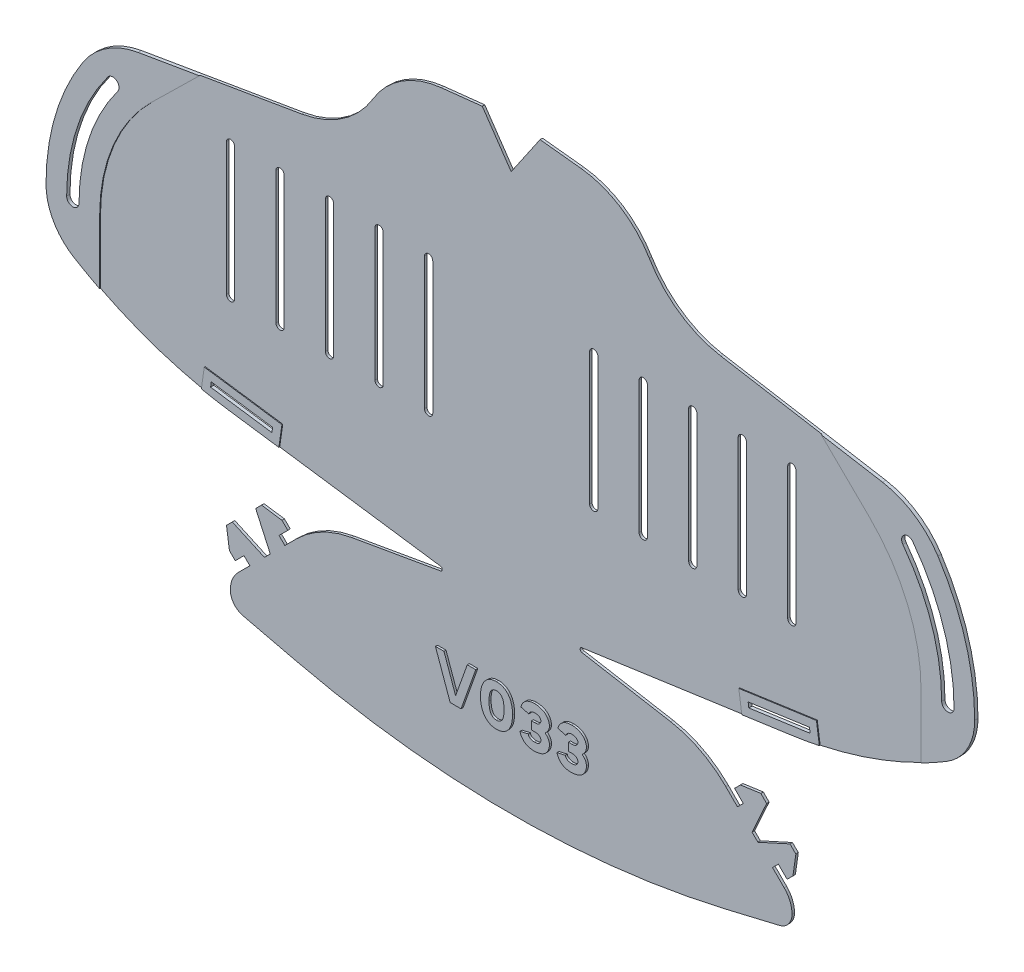
from build123d import *

# Parameters (mm, degrees)
MAIN_SHAPE_DEPTH                   = 0.6
ELASTIC_ATTACHMENT_POINTS_DEPTH    = 184.525502315
REINFORCED_ATTACHMENT_POINTS_DEPTH = 0.2
TAB_SLITS_DEPTH                    = 184.525502315
REINFORCED_TAB_SLITS_DEPTH         = 0.2
TAB_FLEX_RELIEF_DEPTH              = 184.525502315
TAB_FLEX_RELIEF_DEPTH_BACK         = 184.525502315
BREATHING_SLITS_DEPTH              = 184.525502315
VERSION_NUMBER_DEPTH               = 0.5
FILLET1_R                          = 0.5


with BuildPart() as part:
    # Sketch1 → Main Shape (new body)
    with BuildSketch(Plane.XY):
        with BuildLine():
            Line((0, -10.235233266), (-7, 0))
            Line((-7, 0), (-16.941855461, -1.076805455))
            ThreePointArc((-16.941855461, -1.076805455), (-26.448172688, -4.42923559), (-33.461443341, -11.669600897))
            ThreePointArc((-33.461443341, -11.669600897), (-40.804108255, -19.481824954), (-50.74391922, -23.5))
            Line((-50.74391922, -23.5), (-90.180351554, -30.190874742))
            ThreePointArc((-90.180351554, -30.190874742), (-97.811505455, -33.190405434), (-103.597722286, -39))
            ThreePointArc((-103.597722286, -39), (-110.227482046, -53.35351039), (-112.5, -69))
            ThreePointArc((-112.5, -69), (-110.685143325, -75.893640703), (-105.711102551, -81))
            ThreePointArc((-105.711102551, -81), (-87.655491519, -89.524485559), (-68.266232563, -94.291935705))
            Line((-68.266232563, -94.291935705), (-14, -102))
            Line((-14, -102), (-38.626554922, -106.304973016))
            ThreePointArc((-38.626554922, -106.304973016), (-45.849449199, -108.748014338), (-52, -113.254607005))
            Line((-52, -113.254607005), (-54.828307349, -116.0831539))
            Line((-54.828307349, -116.0831539), (-56.242580797, -114.669000226))
            Line((-56.242580797, -114.669000226), (-54.121350285, -112.547590054))
            Line((-54.121350285, -112.547590054), (-55.535623732, -111.13343638))
            Line((-55.535623732, -111.13343638), (-60.48540114, -110.426539202))
            Line((-60.48540114, -110.426539202), (-68.970323187, -118.912179887))
            Line((-68.970323187, -118.912179887), (-68.263006804, -123.861897408))
            Line((-68.263006804, -123.861897408), (-66.848733357, -125.276051082))
            Line((-66.848733357, -125.276051082), (-64.727502845, -123.154640911))
            Line((-64.727502845, -123.154640911), (-63.313229397, -124.568794586))
            Line((-63.313229397, -124.568794586), (-66.141536747, -127.397341481))
            ThreePointArc((-66.141536747, -127.397341481), (-67.550417669, -129.506025763), (-68.045148042, -131.993340924))
            ThreePointArc((-68.045148042, -131.993340924), (-67.183295285, -134.473669911), (-64.9691321, -135.885159709))
            Line((-64.9691321, -135.885159709), (-52.436095294, -138.860716087))
            ThreePointArc((-52.436095294, -138.860716087), (-26.397134772, -143.459954927), (0, -145))
            ThreePointArc((0, -145), (26.397134772, -143.459954927), (52.436095294, -138.860716087))
            Line((52.436095294, -138.860716087), (64.9691321, -135.885159709))
            ThreePointArc((64.9691321, -135.885159709), (67.183295285, -134.473669911), (68.045148042, -131.993340924))
            ThreePointArc((68.045148042, -131.993340924), (67.550417669, -129.506025763), (66.141536747, -127.397341481))
            Line((66.141536747, -127.397341481), (63.313229397, -124.568794586))
            Line((63.313229397, -124.568794586), (64.727502845, -123.154640911))
            Line((64.727502845, -123.154640911), (66.848733357, -125.276051082))
            Line((66.848733357, -125.276051082), (68.263006804, -123.861897408))
            Line((68.263006804, -123.861897408), (68.970323187, -118.912179887))
            Line((68.970323187, -118.912179887), (60.48540114, -110.426539202))
            Line((60.48540114, -110.426539202), (55.535623732, -111.13343638))
            Line((55.535623732, -111.13343638), (54.121350285, -112.547590054))
            Line((54.121350285, -112.547590054), (56.242580797, -114.669000226))
            Line((56.242580797, -114.669000226), (54.828307349, -116.0831539))
            Line((54.828307349, -116.0831539), (52, -113.254607005))
            ThreePointArc((52, -113.254607005), (45.849449199, -108.748014338), (38.626554922, -106.304973016))
            Line((38.626554922, -106.304973016), (14, -102))
            Line((14, -102), (68.266232563, -94.291935705))
            ThreePointArc((68.266232563, -94.291935705), (87.655491519, -89.524485559), (105.711102551, -81))
            ThreePointArc((105.711102551, -81), (110.685143325, -75.893640703), (112.5, -69))
            ThreePointArc((112.5, -69), (110.227482046, -53.35351039), (103.597722286, -39))
            ThreePointArc((103.597722286, -39), (97.811505455, -33.190405434), (90.180351554, -30.190874742))
            Line((90.180351554, -30.190874742), (50.74391922, -23.5))
            ThreePointArc((50.74391922, -23.5), (40.804108255, -19.481824954), (33.461443341, -11.669600897))
            ThreePointArc((33.461443341, -11.669600897), (26.448172688, -4.42923559), (16.941855461, -1.076805455))
            Line((16.941855461, -1.076805455), (7, 0))
            Line((7, 0), (0, -10.235233266))
        make_face()
    extrude(amount=MAIN_SHAPE_DEPTH)

    # Sketch2 → Elastic Attachment Points (cut, through all)
    with BuildSketch(Plane.XY.offset(0.6)):
        with BuildLine():
            ThreePointArc((-97.5, -39), (-104.934164903, -53.188611699), (-107.5, -69))
            ThreePointArc((-107.5, -69), (-106, -70.5), (-104.5, -69))
            ThreePointArc((-104.5, -69), (-102.088115008, -54.137294997), (-95.1, -40.8))
            ThreePointArc((-95.1, -40.8), (-95.4, -38.7), (-97.5, -39))
        make_face()
        with BuildLine():
            ThreePointArc((97.5, -39), (104.934164903, -53.188611699), (107.5, -69))
            ThreePointArc((107.5, -69), (106, -70.5), (104.5, -69))
            ThreePointArc((104.5, -69), (102.088115008, -54.137294997), (95.1, -40.8))
            ThreePointArc((95.1, -40.8), (95.4, -38.7), (97.5, -39))
        make_face()
    extrude(amount=-ELASTIC_ATTACHMENT_POINTS_DEPTH, mode=Mode.SUBTRACT)

    # Sketch7 → Reinforced Attachment Points (add)
    # profile 1 of 2: a face of its own
    with BuildSketch(Plane.XY.offset(0.6)):
        with BuildLine():
            Line((-99.5, -69), (-99.5, -84.438405623))
            ThreePointArc((-99.5, -84.438405623), (-102.636073846, -82.774338486), (-105.711102551, -81))
            ThreePointArc((-105.711102551, -81), (-110.685143325, -75.893640703), (-112.5, -69))
            ThreePointArc((-112.5, -69), (-110.227482046, -53.35351039), (-103.597722286, -39))
            ThreePointArc((-103.597722286, -39), (-97.811505455, -33.190405434), (-90.180351554, -30.190874742))
            Line((-90.180351554, -30.190874742), (-75.331937335, -27.671659038))
            Line((-75.331937335, -27.671659038), (-86.893876913, -39))
            ThreePointArc((-86.893876913, -39), (-96.22042633, -52.729517991), (-99.5, -69))
        make_face()
        with BuildLine():
            ThreePointArc((-107.5, -69), (-106, -70.5), (-104.5, -69))
            ThreePointArc((-104.5, -69), (-102.088115008, -54.137294997), (-95.1, -40.8))
            ThreePointArc((-95.1, -40.8), (-95.4, -38.7), (-97.5, -39))
            ThreePointArc((-97.5, -39), (-104.934164903, -53.188611699), (-107.5, -69))
        make_face(mode=Mode.SUBTRACT)
    # profile 2 of 2: a face of its own
    with BuildSketch(Plane.XY.offset(0.6)):
        with BuildLine():
            Line((75.331937335, -27.671659038), (90.180351554, -30.190874742))
            ThreePointArc((90.180351554, -30.190874742), (97.811505455, -33.190405434), (103.597722286, -39))
            ThreePointArc((103.597722286, -39), (110.227482046, -53.35351039), (112.5, -69))
            ThreePointArc((112.5, -69), (110.685143325, -75.893640703), (105.711102551, -81))
            ThreePointArc((105.711102551, -81), (102.636073846, -82.774338486), (99.5, -84.438405623))
            Line((99.5, -84.438405623), (99.5, -69))
            ThreePointArc((99.5, -69), (96.22042633, -52.729517991), (86.893876913, -39))
            Line((86.893876913, -39), (75.331937335, -27.671659038))
        make_face()
        with BuildLine():
            ThreePointArc((104.5, -69), (106, -70.5), (107.5, -69))
            ThreePointArc((107.5, -69), (104.934164903, -53.188611699), (97.5, -39))
            ThreePointArc((97.5, -39), (95.4, -38.7), (95.1, -40.8))
            ThreePointArc((95.1, -40.8), (102.088115008, -54.137294997), (104.5, -69))
        make_face(mode=Mode.SUBTRACT)
    extrude(amount=REINFORCED_ATTACHMENT_POINTS_DEPTH)

    # Sketch6 → Tab Slits (cut, through all)
    with BuildSketch(Plane.XY.offset(0.6)):
        Polygon((-72.627441637, -91.652387373), (-57.776508424, -93.761838179), (-57.60775236, -92.573763522), (-72.458685573, -90.464312716), align=None)
        Polygon((72.627441637, -91.652387373), (72.458685573, -90.464312716), (57.60775236, -92.573763522), (57.776508424, -93.761838179), align=None)
    extrude(amount=-TAB_SLITS_DEPTH, mode=Mode.SUBTRACT)

    # Sketch9 → Reinforced Tab Slits (add)
    # profile 1 of 2: a face of its own
    with BuildSketch(Plane.XY.offset(0.6)):
        with BuildLine():
            Line((-56.077644103, -96.023222715), (-55.346367824, -90.874899201))
            Line((-55.346367824, -90.874899201), (-74.157549894, -88.20292818))
            Line((-74.157549894, -88.20292818), (-74.857329404, -93.129508476))
            ThreePointArc((-74.857329404, -93.129508476), (-71.571508598, -93.76587879), (-68.266232563, -94.291935705))
            Line((-68.266232563, -94.291935705), (-56.077644103, -96.023222715))
        make_face()
        Polygon((-57.776508424, -93.761838179), (-57.60775236, -92.573763522), (-72.458685573, -90.464312716), (-72.627441637, -91.652387373), align=None, mode=Mode.SUBTRACT)
    # profile 2 of 2: a face of its own
    with BuildSketch(Plane.XY.offset(0.6)):
        with BuildLine():
            Line((68.266232563, -94.291935705), (56.077644103, -96.023222715))
            Line((56.077644103, -96.023222715), (55.346367824, -90.874899201))
            Line((55.346367824, -90.874899201), (74.157549894, -88.20292818))
            Line((74.157549894, -88.20292818), (74.857329404, -93.129508476))
            ThreePointArc((74.857329404, -93.129508476), (71.571508598, -93.76587879), (68.266232563, -94.291935705))
        make_face()
        Polygon((57.60775236, -92.573763522), (72.458685573, -90.464312716), (72.627441637, -91.652387373), (57.776508424, -93.761838179), align=None, mode=Mode.SUBTRACT)
    extrude(amount=REINFORCED_TAB_SLITS_DEPTH)

    # Sketch11 → Tab Flex Relief (cut, two sides: drawn at the far end of the back side and taken through both)
    with BuildSketch(Plane.XY.offset(0.6).offset(-TAB_FLEX_RELIEF_DEPTH_BACK)):
        Polygon((-67.556169513, -117.49790644), (-59.777845211, -121.033110967), (-58.363691536, -119.618837519), (-61.899554814, -111.840812649), align=None)
        Polygon((61.899554814, -111.840812649), (67.556169513, -117.49790644), (59.777845211, -121.033110967), (58.363691536, -119.618837519), align=None)
    extrude(amount=TAB_FLEX_RELIEF_DEPTH + TAB_FLEX_RELIEF_DEPTH_BACK, mode=Mode.SUBTRACT)

    # Sketch3 → Breathing Slits (cut, through all)
    with BuildSketch(Plane.XY.offset(0.6)):
        with BuildLine():
            Line((-19, -38.45), (-19, -70.45))
            ThreePointArc((-19, -70.45), (-20, -71.45), (-21, -70.45))
            Line((-21, -70.45), (-21, -38.45))
            ThreePointArc((-21, -38.45), (-20, -37.45), (-19, -38.45))
        make_face()
        with BuildLine():
            Line((-31, -38.45), (-31, -70.45))
            ThreePointArc((-31, -70.45), (-32, -71.45), (-33, -70.45))
            Line((-33, -70.45), (-33, -38.45))
            ThreePointArc((-33, -38.45), (-32, -37.45), (-31, -38.45))
        make_face()
        with BuildLine():
            Line((-43, -38.45), (-43, -70.45))
            ThreePointArc((-43, -70.45), (-44, -71.45), (-45, -70.45))
            Line((-45, -70.45), (-45, -38.45))
            ThreePointArc((-45, -38.45), (-44, -37.45), (-43, -38.45))
        make_face()
        with BuildLine():
            Line((-55, -38.45), (-55, -70.45))
            ThreePointArc((-55, -70.45), (-56, -71.45), (-57, -70.45))
            Line((-57, -70.45), (-57, -38.45))
            ThreePointArc((-57, -38.45), (-56, -37.45), (-55, -38.45))
        make_face()
        with BuildLine():
            Line((-67, -38.45), (-67, -70.45))
            ThreePointArc((-67, -70.45), (-68, -71.45), (-69, -70.45))
            Line((-69, -70.45), (-69, -38.45))
            ThreePointArc((-69, -38.45), (-68, -37.45), (-67, -38.45))
        make_face()
        with BuildLine():
            Line((19, -38.45), (19, -70.45))
            ThreePointArc((19, -70.45), (20, -71.45), (21, -70.45))
            Line((21, -70.45), (21, -38.45))
            ThreePointArc((21, -38.45), (20, -37.45), (19, -38.45))
        make_face()
        with BuildLine():
            Line((31, -38.45), (31, -70.45))
            ThreePointArc((31, -70.45), (32, -71.45), (33, -70.45))
            Line((33, -70.45), (33, -38.45))
            ThreePointArc((33, -38.45), (32, -37.45), (31, -38.45))
        make_face()
        with BuildLine():
            Line((43, -38.45), (43, -70.45))
            ThreePointArc((43, -70.45), (44, -71.45), (45, -70.45))
            Line((45, -70.45), (45, -38.45))
            ThreePointArc((45, -38.45), (44, -37.45), (43, -38.45))
        make_face()
        with BuildLine():
            Line((55, -38.45), (55, -70.45))
            ThreePointArc((55, -70.45), (56, -71.45), (57, -70.45))
            Line((57, -70.45), (57, -38.45))
            ThreePointArc((57, -38.45), (56, -37.45), (55, -38.45))
        make_face()
        with BuildLine():
            Line((67, -38.45), (67, -70.45))
            ThreePointArc((67, -70.45), (68, -71.45), (69, -70.45))
            Line((69, -70.45), (69, -38.45))
            ThreePointArc((69, -38.45), (68, -37.45), (67, -38.45))
        make_face()
    extrude(amount=-BREATHING_SLITS_DEPTH, mode=Mode.SUBTRACT)

    # Sketch8 → Version Number (add)
    # profile 1 of 4: a face of its own
    with BuildSketch(Plane.XY.offset(0.6)):
        Polygon((-14.279551662, -128.5), (-11.644631028, -128.5), (-8.073202456, -118.5), (-10.13669452, -118.5), (-12.962091345, -126.420634921), (-15.78748817, -118.5), (-17.850980234, -118.5), align=None)
    # profile 2 of 4: a face of its own
    with BuildSketch(Plane.XY.offset(0.6)):
        with BuildLine():
            add(Edge.make_bspline(
                [(-3.051027777, -118.5), (-3.19539374, -118.505695671), (-3.478148888, -118.51685121), (-3.891283889, -118.5745591), (-4.279126593, -118.680335178), (-4.646328168, -118.819656178), (-4.98860374, -119.003303471), (-5.312396914, -119.221085059), (-5.605407529, -119.487440084), (-5.880862582, -119.785519386), (-6.126725763, -120.12453761), (-6.340161473, -120.500892889), (-6.522124249, -120.912503383), (-6.671045413, -121.360169436), (-6.786594461, -121.844506854), (-6.8743484, -122.364485904), (-6.925902839, -122.921030718), (-6.936559569, -123.303893775), (-6.942038151, -123.500722112)],
                knots=[0, 0, 0, 0, 0.970159994, 1.900155169, 2.79438565, 3.665191596, 4.532301255, 5.397946305, 6.279238358, 7.185391655, 8.120220805, 9.085107467, 10.08639026, 11.138349125, 12.249459105, 13.427760297, 14.677622047, 16, 16, 16, 16], degree=3))
            add(Edge.make_bspline(
                [(-6.942038151, -123.500722112), (-6.93661476, -123.69832053), (-6.926106134, -124.081196856), (-6.874139064, -124.637697099), (-6.786693174, -125.156966907), (-6.670583318, -125.641884177), (-6.522640654, -126.090648826), (-6.340094029, -126.502814664), (-6.126783725, -126.879260377), (-5.880702545, -127.218032326), (-5.606310807, -127.51659595), (-5.310843261, -127.779877259), (-4.989492019, -128.000979952), (-4.646134714, -128.183632701), (-4.279581659, -128.324409639), (-3.89062858, -128.425104033), (-3.47885026, -128.488808035), (-3.196068886, -128.496221224), (-3.051924811, -128.5)],
                knots=[0, 0, 0, 0, 1.327400251, 2.57203543, 3.750234214, 4.861247624, 5.917991082, 6.919186852, 7.883989653, 8.818737555, 9.724812096, 10.602616666, 11.47109776, 12.338132057, 13.208862319, 14.101698703, 15.032365954, 16, 16, 16, 16], degree=3))
            add(Edge.make_bspline(
                [(-3.051924811, -128.5), (-2.907785142, -128.496210687), (-2.625012412, -128.488776824), (-2.213171998, -128.425221319), (-1.823749667, -128.323813307), (-1.456388189, -128.184839888), (-1.11399871, -128.000200623), (-0.792952303, -127.779984633), (-0.497553635, -127.516566079), (-0.223143835, -127.218040576), (0.022936792, -126.879258594), (0.236229534, -126.502813072), (0.418851411, -126.090657611), (0.566489149, -125.641847927), (0.683801999, -125.157235462), (0.766244145, -124.637275213), (0.82390037, -124.081441513), (0.831810739, -123.698369528), (0.835892123, -123.500722112)],
                knots=[0, 0, 0, 0, 0.96765053, 1.898333634, 2.791185227, 3.666728435, 4.529238626, 5.397734515, 6.275554038, 7.181644014, 8.116407839, 9.081227075, 10.082439899, 11.139201358, 12.250233695, 13.427610983, 14.672766316, 16, 16, 16, 16], degree=3))
            add(Edge.make_bspline(
                [(0.835892123, -123.500722112), (0.831751293, -123.303845261), (0.823694588, -122.920787111), (0.766450609, -122.364907693), (0.683702415, -121.844238468), (0.566952779, -121.360205444), (0.418334814, -120.912494629), (0.236296996, -120.500894477), (0.022878819, -120.124539393), (-0.222983775, -119.785511139), (-0.498457012, -119.487469991), (-0.79139822, -119.220977415), (-1.114883082, -119.004075275), (-1.45619473, -118.818455332), (-1.824205294, -118.680915067), (-2.212521926, -118.574534625), (-2.625371004, -118.516562336), (-2.907855835, -118.506550382), (-3.051924811, -118.501444225)],
                knots=[0, 0, 0, 0, 1.322391154, 2.572941942, 3.750582404, 4.861863084, 5.913983562, 6.915420183, 7.880455081, 8.815427849, 9.721720359, 10.603147806, 11.468925845, 12.331628829, 13.207367743, 14.101735605, 15.031873656, 16, 16, 16, 16], degree=3))
            Line((-3.051924811, -118.501444225), (-3.051027777, -118.5))
        make_face()
        with BuildLine():
            add(Edge.make_bspline(
                [(-3.051027777, -126.579365079), (-3.120347324, -126.580142247), (-3.25635765, -126.581667111), (-3.453810887, -126.549518886), (-3.640261982, -126.50001124), (-3.814439277, -126.424863461), (-3.978234638, -126.32888552), (-4.128850181, -126.207295998), (-4.267209205, -126.063513987), (-4.394524263, -125.896932623), (-4.508395565, -125.703005633), (-4.606926554, -125.478827118), (-4.687663969, -125.222713054), (-4.756840727, -124.937433189), (-4.808092092, -124.621763618), (-4.846595657, -124.276117752), (-4.872462321, -123.899148475), (-4.875821596, -123.63702081), (-4.87756832, -123.500722112)],
                knots=[0, 0, 0, 0, 0.820209436, 1.609314487, 2.362064528, 3.101854642, 3.850272983, 4.605479342, 5.3882482, 6.210255141, 7.084711649, 8.047345167, 9.106040688, 10.263495908, 11.523832392, 12.893430008, 14.384674726, 16, 16, 16, 16], degree=3))
            add(Edge.make_bspline(
                [(-4.87756832, -123.500722112), (-4.875814709, -123.364424703), (-4.87244219, -123.102299516), (-4.846666545, -122.725313211), (-4.807773571, -122.378974061), (-4.757477287, -122.063111109), (-4.687259864, -121.778059679), (-4.606956833, -121.522619394), (-4.508426672, -121.298401339), (-4.394392013, -121.104640769), (-4.268001709, -120.937923887), (-4.128039223, -120.796456824), (-3.978318472, -120.674830172), (-3.814478587, -120.578630118), (-3.639832567, -120.50465551), (-3.45446502, -120.450210023), (-3.256321312, -120.423926373), (-3.120878039, -120.422146526), (-3.051924811, -120.421240419)],
                knots=[0, 0, 0, 0, 1.616177311, 3.108208617, 4.478528655, 5.748482895, 6.897727805, 7.956981757, 8.920123036, 9.795040793, 10.617481319, 11.394165711, 12.149770419, 12.898583529, 13.63876386, 14.394368568, 15.182584207, 16, 16, 16, 16], degree=3))
            add(Edge.make_bspline(
                [(-3.051924811, -120.421240419), (-2.982973175, -120.422149219), (-2.847533031, -120.423934355), (-2.64936681, -120.450179948), (-2.464080223, -120.504762296), (-2.289746876, -120.577982734), (-2.127521541, -120.675595023), (-1.978051783, -120.796360516), (-1.838151536, -120.937948802), (-1.711787224, -121.104645093), (-1.597562487, -121.298351736), (-1.499777206, -121.523063414), (-1.415817348, -121.777554553), (-1.346628249, -122.063195246), (-1.29599857, -122.378948588), (-1.257206456, -122.725320897), (-1.231400792, -123.102297333), (-1.228032641, -123.364423957), (-1.226281301, -123.500722112)],
                knots=[0, 0, 0, 0, 0.817669415, 1.606129616, 2.361968767, 3.102378757, 3.843623451, 4.599462602, 5.376387978, 6.199083685, 7.074272906, 8.037713021, 9.100132017, 10.249733507, 11.520081779, 12.89082699, 14.383321233, 16, 16, 16, 16], degree=3))
            add(Edge.make_bspline(
                [(-1.226281301, -123.500722112), (-1.228025755, -123.637021556), (-1.231380663, -123.899150658), (-1.257277338, -124.276110066), (-1.295680288, -124.621789015), (-1.347263507, -124.937349474), (-1.415405372, -125.223220708), (-1.499806884, -125.478383327), (-1.597593739, -125.703055181), (-1.711654918, -125.896928348), (-1.838944061, -126.063488884), (-1.977240151, -126.207393621), (-2.12760424, -126.328120602), (-2.289785467, -126.425517476), (-2.463650718, -126.499891817), (-2.650020055, -126.549600883), (-2.847209684, -126.581404352), (-2.98290822, -126.580608552), (-3.051924811, -126.580203806)],
                knots=[0, 0, 0, 0, 1.616177474, 3.108208932, 4.478529109, 5.739530511, 6.897596372, 7.959685938, 8.922827315, 9.797745161, 10.620185771, 11.403367596, 12.15897238, 12.899987232, 13.640167639, 14.39331481, 15.182836171, 16, 16, 16, 16], degree=3))
            Line((-3.051924811, -126.580203806), (-3.051027777, -126.579365079))
        make_face(mode=Mode.SUBTRACT)
    # profile 3 of 4: a face of its own
    with BuildSketch(Plane.XY.offset(0.6)):
        with BuildLine():
            Line((6.271577031, -124.404761905), (6.366815126, -124.404761905))
            add(Edge.make_bspline(
                [(6.366815126, -124.404761905), (6.467083021, -124.411299477), (6.657718223, -124.423729091), (6.924384519, -124.486416557), (7.157178608, -124.578961335), (7.348865985, -124.709274647), (7.502511287, -124.861365804), (7.616838726, -125.032278467), (7.68649997, -125.222537651), (7.695375407, -125.355662585), (7.699852438, -125.422814713)],
                knots=[0, 0, 0, 0, 1.293250512, 2.458803691, 3.516087315, 4.504014474, 5.424976382, 6.287022232, 7.135923681, 8, 8, 8, 8], degree=3))
            add(Edge.make_bspline(
                [(7.699852438, -125.422814713), (7.696562888, -125.504440638), (7.690201902, -125.662280257), (7.62105453, -125.887718235), (7.502699673, -126.087113891), (7.367783836, -126.23073656), (7.23861918, -126.331172702), (7.123730184, -126.395688771), (6.994879285, -126.450185226), (6.851851279, -126.49595932), (6.69512982, -126.532200484), (6.524170883, -126.560253509), (6.33834716, -126.575366879), (6.209508164, -126.5785552), (6.142888539, -126.580203806)],
                knots=[0, 0, 0, 0, 1.334208421, 2.579951764, 3.816761299, 5.103436918, 5.78324123, 6.491044783, 7.25516555, 8.072210043, 8.94833879, 9.888551629, 10.908219533, 12, 12, 12, 12], degree=3))
            add(Edge.make_bspline(
                [(6.142888539, -126.580203806), (6.068494948, -126.579024673), (5.918010355, -126.576639503), (5.691363809, -126.537785365), (5.463088851, -126.472292557), (5.235991452, -126.384048723), (5.021834851, -126.26078738), (4.844512322, -126.088542309), (4.703342567, -125.87591894), (4.648773412, -125.712337396), (4.620370744, -125.62719493)],
                knots=[0, 0, 0, 0, 0.920255672, 1.861508472, 2.836752399, 3.857684402, 4.873720033, 5.872631744, 6.892727297, 8, 8, 8, 8], degree=3))
            Line((4.620370744, -125.62719493), (2.636656396, -126.071428571))
            add(Edge.make_bspline(
                [(2.636656396, -126.071428571), (2.65949168, -126.160336196), (2.704447825, -126.335369884), (2.797456704, -126.586847228), (2.908894142, -126.824009097), (3.034050485, -127.050933458), (3.182201572, -127.26169635), (3.346370111, -127.459934114), (3.525601641, -127.647890635), (3.725933933, -127.819546753), (3.943380911, -127.976110236), (4.180527485, -128.112422888), (4.435092983, -128.230322428), (4.710630373, -128.322934743), (5.002747988, -128.399729339), (5.314016557, -128.45295857), (5.642847536, -128.491934936), (5.868729028, -128.497268097), (5.984436461, -128.5)],
                knots=[0, 0, 0, 0, 0.97897001, 1.927311989, 2.855460552, 3.773345826, 4.68872018, 5.599601379, 6.518067916, 7.456260856, 8.41049365, 9.372940738, 10.370680865, 11.39871829, 12.470472684, 13.590411754, 14.765692276, 16, 16, 16, 16], degree=3))
            add(Edge.make_bspline(
                [(5.984436461, -128.5), (6.140706347, -128.494245394), (6.443232397, -128.483104934), (6.881041186, -128.435865678), (7.286689568, -128.358387224), (7.66046436, -128.252017359), (8.005338054, -128.123277608), (8.316323474, -127.961059217), (8.598414909, -127.774497038), (8.846068931, -127.55815064), (9.060463644, -127.319870658), (9.252221218, -127.071551477), (9.410010509, -126.805353082), (9.542541163, -126.527874631), (9.641168787, -126.234513517), (9.712632491, -125.928607165), (9.754304892, -125.607680152), (9.759422526, -125.38925418), (9.762025861, -125.278141077)],
                knots=[0, 0, 0, 0, 1.338573179, 2.591371041, 3.766159492, 4.869841347, 5.915366975, 6.911991706, 7.866279139, 8.804635322, 9.718527085, 10.607232931, 11.486170613, 12.362759498, 13.235296616, 14.130311397, 15.048891017, 16, 16, 16, 16], degree=3))
            add(Edge.make_bspline(
                [(9.762025861, -125.278141077), (9.756677435, -125.181448476), (9.746150675, -124.991138356), (9.69083509, -124.713321084), (9.598475202, -124.451246621), (9.469283463, -124.20784025), (9.318083758, -123.977552327), (9.142952342, -123.764837772), (8.948555296, -123.566155092), (8.80413063, -123.449574998), (8.73093915, -123.39049458)],
                knots=[0, 0, 0, 0, 1.042147361, 2.051151675, 3.039496243, 4.024119517, 5.012016893, 6.002285516, 6.987598979, 8, 8, 8, 8], degree=3))
            add(Edge.make_bspline(
                [(8.73093915, -123.39049458), (8.804120184, -123.325162044), (8.948480941, -123.19628365), (9.142753063, -122.981710509), (9.316923769, -122.755542958), (9.470279521, -122.515248899), (9.597481046, -122.261642739), (9.690305135, -121.993228321), (9.746213398, -121.711764564), (9.756698785, -121.519933272), (9.762025861, -121.42247384)],
                knots=[0, 0, 0, 0, 1.026734164, 2.025389794, 3.025877614, 4.013273499, 5.006315215, 5.989929209, 6.978788314, 8, 8, 8, 8], degree=3))
            add(Edge.make_bspline(
                [(9.762025861, -121.42247384), (9.757943996, -121.322020203), (9.749925017, -121.124675201), (9.70298232, -120.835115028), (9.627804305, -120.558271626), (9.520362248, -120.294880847), (9.386946652, -120.042407113), (9.222134738, -119.803370965), (9.03110556, -119.574583887), (8.810274701, -119.361344215), (8.563575543, -119.166999953), (8.291767327, -118.995833154), (7.997228637, -118.84746887), (7.676452584, -118.730513446), (7.334536967, -118.632405283), (6.968657131, -118.562780212), (6.579581976, -118.515976725), (6.312193885, -118.506371293), (6.175038236, -118.501444225)],
                knots=[0, 0, 0, 0, 0.933249724, 1.833404674, 2.71837752, 3.592513965, 4.4704886, 5.365912677, 6.284554944, 7.234984132, 8.212272519, 9.196674926, 10.214289296, 11.269589965, 12.363543901, 13.515449053, 14.72555956, 16, 16, 16, 16], degree=3))
            add(Edge.make_bspline(
                [(6.175038236, -118.501444225), (6.061645884, -118.504384419), (5.840465125, -118.510119502), (5.517680855, -118.546209564), (5.21185155, -118.597359567), (4.923032824, -118.671164203), (4.651989267, -118.76520159), (4.398267184, -118.877770477), (4.16173765, -119.009217236), (3.94413438, -119.161041577), (3.743873805, -119.328960798), (3.562476817, -119.510905494), (3.397729823, -119.704452098), (3.253195647, -119.91288512), (3.123566172, -120.132286581), (3.017031143, -120.36651166), (2.922112184, -120.610059019), (2.878707966, -120.780460499), (2.856730222, -120.866743363)],
                knots=[0, 0, 0, 0, 1.229240767, 2.397731417, 3.51786287, 4.588673614, 5.625367482, 6.624717489, 7.594406979, 8.554388623, 9.496885304, 10.424058211, 11.336820069, 12.248524965, 13.170856983, 14.095351914, 15.035580601, 16, 16, 16, 16], degree=3))
            Line((2.856730222, -120.866743363), (4.763640523, -121.373015873))
            add(Edge.make_bspline(
                [(4.763640523, -121.373015873), (4.774938173, -121.326631527), (4.799454349, -121.22597637), (4.889955476, -121.081457089), (5.01180415, -120.927147787), (5.173016925, -120.771324055), (5.370394698, -120.625559671), (5.608484676, -120.514206488), (5.881569063, -120.446844288), (6.0743985, -120.430020784), (6.175038236, -120.421240419)],
                knots=[0, 0, 0, 0, 0.626586808, 1.359708585, 2.222843852, 3.223153095, 4.308434095, 5.447412619, 6.667777482, 8, 8, 8, 8], degree=3))
            add(Edge.make_bspline(
                [(6.175038236, -120.421240419), (6.247071222, -120.423218633), (6.385306711, -120.42701494), (6.582710033, -120.449676308), (6.76300166, -120.474391788), (6.924051066, -120.515621967), (7.069666073, -120.558109891), (7.194275259, -120.618078056), (7.305036594, -120.680273756), (7.419940282, -120.780934624), (7.534268273, -120.912654377), (7.637262225, -121.077310889), (7.69725924, -121.24921056), (7.698998308, -121.365405566), (7.699852438, -121.42247384)],
                knots=[0, 0, 0, 0, 1.26888152, 2.435057415, 3.499383416, 4.470882074, 5.362320585, 6.164854387, 6.902680001, 7.591682225, 8.843898063, 9.963361673, 10.999720905, 12, 12, 12, 12], degree=3))
            add(Edge.make_bspline(
                [(7.699852438, -121.42247384), (7.694781684, -121.49199044), (7.684703485, -121.630155711), (7.609424673, -121.827940252), (7.48789936, -122.008163808), (7.324572613, -122.171288708), (7.117236705, -122.307565764), (6.86969973, -122.408872593), (6.582819396, -122.47003825), (6.378964553, -122.480300003), (6.271487327, -122.485710249)],
                knots=[0, 0, 0, 0, 0.842573162, 1.674626639, 2.532888499, 3.465967991, 4.458251597, 5.524776888, 6.695002246, 8, 8, 8, 8], degree=3))
            Line((6.271487327, -122.485710249), (5.414434173, -122.484126984))
            Line((5.414434173, -122.484126984), (5.414434173, -124.404761905))
            Line((5.414434173, -124.404761905), (6.271577031, -124.404761905))
        make_face()
    # profile 4 of 4: a face of its own
    with BuildSketch(Plane.XY.offset(0.6)):
        with BuildLine():
            Line((15.236749687, -124.404761905), (15.331987782, -124.404761905))
            add(Edge.make_bspline(
                [(15.331987782, -124.404761905), (15.432255678, -124.411299477), (15.622890879, -124.423729091), (15.889557176, -124.486416557), (16.122351264, -124.578961335), (16.314038642, -124.709274647), (16.467683943, -124.861365804), (16.582011382, -125.032278467), (16.651672626, -125.222537651), (16.660548063, -125.355662585), (16.665025095, -125.422814713)],
                knots=[0, 0, 0, 0, 1.293250512, 2.458803691, 3.516087315, 4.504014474, 5.424976382, 6.287022232, 7.135923681, 8, 8, 8, 8], degree=3))
            add(Edge.make_bspline(
                [(16.665025095, -125.422814713), (16.661735544, -125.504440638), (16.655374558, -125.662280257), (16.586227187, -125.887718235), (16.467872329, -126.087113891), (16.332956492, -126.23073656), (16.203791837, -126.331172702), (16.088902841, -126.395688771), (15.960051942, -126.450185226), (15.817023936, -126.49595932), (15.660302476, -126.532200484), (15.489343539, -126.560253509), (15.303519817, -126.575366879), (15.174680821, -126.5785552), (15.108061196, -126.580203806)],
                knots=[0, 0, 0, 0, 1.334208421, 2.579951764, 3.816761299, 5.103436918, 5.78324123, 6.491044783, 7.25516555, 8.072210043, 8.94833879, 9.888551629, 10.908219533, 12, 12, 12, 12], degree=3))
            add(Edge.make_bspline(
                [(15.108061196, -126.580203806), (15.033667605, -126.579024673), (14.883183012, -126.576639503), (14.656536466, -126.537785365), (14.428261508, -126.472292557), (14.201164108, -126.384048723), (13.987007508, -126.26078738), (13.809684979, -126.088542309), (13.668515223, -125.87591894), (13.613946069, -125.712337396), (13.585543401, -125.62719493)],
                knots=[0, 0, 0, 0, 0.920255672, 1.861508472, 2.836752399, 3.857684402, 4.873720033, 5.872631744, 6.892727297, 8, 8, 8, 8], degree=3))
            Line((13.585543401, -125.62719493), (11.601829052, -126.071428571))
            add(Edge.make_bspline(
                [(11.601829052, -126.071428571), (11.624664337, -126.160336196), (11.669620481, -126.335369884), (11.762629361, -126.586847228), (11.874066798, -126.824009097), (11.999223142, -127.050933458), (12.147374228, -127.26169635), (12.311542768, -127.459934114), (12.490774297, -127.647890635), (12.69110659, -127.819546753), (12.908553568, -127.976110236), (13.145700141, -128.112422888), (13.40026564, -128.230322428), (13.675803029, -128.322934743), (13.967920645, -128.399729339), (14.279189214, -128.45295857), (14.608020193, -128.491934936), (14.833901685, -128.497268097), (14.949609117, -128.5)],
                knots=[0, 0, 0, 0, 0.97897001, 1.927311989, 2.855460552, 3.773345826, 4.68872018, 5.599601379, 6.518067916, 7.456260856, 8.41049365, 9.372940738, 10.370680865, 11.39871829, 12.470472684, 13.590411754, 14.765692276, 16, 16, 16, 16], degree=3))
            add(Edge.make_bspline(
                [(14.949609117, -128.5), (15.105879003, -128.494245394), (15.408405054, -128.483104934), (15.846213843, -128.435865678), (16.251862225, -128.358387224), (16.625637017, -128.252017359), (16.97051071, -128.123277608), (17.281496131, -127.961059217), (17.563587566, -127.774497038), (17.811241588, -127.55815064), (18.025636301, -127.319870658), (18.217393875, -127.071551477), (18.375183166, -126.805353082), (18.50771382, -126.527874631), (18.606341444, -126.234513517), (18.677805148, -125.928607165), (18.719477549, -125.607680152), (18.724595182, -125.38925418), (18.727198518, -125.278141077)],
                knots=[0, 0, 0, 0, 1.338573179, 2.591371041, 3.766159492, 4.869841347, 5.915366975, 6.911991706, 7.866279139, 8.804635322, 9.718527085, 10.607232931, 11.486170613, 12.362759498, 13.235296616, 14.130311397, 15.048891017, 16, 16, 16, 16], degree=3))
            add(Edge.make_bspline(
                [(18.727198518, -125.278141077), (18.721850091, -125.181448476), (18.711323332, -124.991138356), (18.656007747, -124.713321084), (18.563647859, -124.451246621), (18.43445612, -124.20784025), (18.283256415, -123.977552327), (18.108124998, -123.764837772), (17.913727952, -123.566155092), (17.769303286, -123.449574998), (17.696111806, -123.39049458)],
                knots=[0, 0, 0, 0, 1.042147361, 2.051151675, 3.039496243, 4.024119517, 5.012016893, 6.002285516, 6.987598979, 8, 8, 8, 8], degree=3))
            add(Edge.make_bspline(
                [(17.696111806, -123.39049458), (17.769292841, -123.325162044), (17.913653598, -123.19628365), (18.10792572, -122.981710509), (18.282096426, -122.755542958), (18.435452178, -122.515248899), (18.562653702, -122.261642739), (18.655477791, -121.993228321), (18.711386055, -121.711764564), (18.721871442, -121.519933272), (18.727198518, -121.42247384)],
                knots=[0, 0, 0, 0, 1.026734164, 2.025389794, 3.025877614, 4.013273499, 5.006315215, 5.989929209, 6.978788314, 8, 8, 8, 8], degree=3))
            add(Edge.make_bspline(
                [(18.727198518, -121.42247384), (18.723116653, -121.322020203), (18.715097674, -121.124675201), (18.668154976, -120.835115028), (18.592976962, -120.558271626), (18.485534904, -120.294880847), (18.352119309, -120.042407113), (18.187307394, -119.803370965), (17.996278216, -119.574583887), (17.775447358, -119.361344215), (17.5287482, -119.166999953), (17.256939983, -118.995833154), (16.962401294, -118.84746887), (16.641625241, -118.730513446), (16.299709624, -118.632405283), (15.933829787, -118.562780212), (15.544754633, -118.515976725), (15.277366541, -118.506371293), (15.140210893, -118.501444225)],
                knots=[0, 0, 0, 0, 0.933249724, 1.833404674, 2.71837752, 3.592513965, 4.4704886, 5.365912677, 6.284554944, 7.234984132, 8.212272519, 9.196674926, 10.214289296, 11.269589965, 12.363543901, 13.515449053, 14.72555956, 16, 16, 16, 16], degree=3))
            add(Edge.make_bspline(
                [(15.140210893, -118.501444225), (15.02681854, -118.504384419), (14.805637781, -118.510119502), (14.482853511, -118.546209564), (14.177024207, -118.597359567), (13.888205481, -118.671164203), (13.617161924, -118.76520159), (13.36343984, -118.877770477), (13.126910307, -119.009217236), (12.909307037, -119.161041577), (12.709046461, -119.328960798), (12.527649473, -119.510905494), (12.36290248, -119.704452098), (12.218368304, -119.91288512), (12.088738829, -120.132286581), (11.9822038, -120.36651166), (11.887284841, -120.610059019), (11.843880623, -120.780460499), (11.821902878, -120.866743363)],
                knots=[0, 0, 0, 0, 1.229240767, 2.397731417, 3.51786287, 4.588673614, 5.625367482, 6.624717489, 7.594406979, 8.554388623, 9.496885304, 10.424058211, 11.336820069, 12.248524965, 13.170856983, 14.095351914, 15.035580601, 16, 16, 16, 16], degree=3))
            Line((11.821902878, -120.866743363), (13.728813179, -121.373015873))
            add(Edge.make_bspline(
                [(13.728813179, -121.373015873), (13.74011083, -121.326631527), (13.764627005, -121.22597637), (13.855128132, -121.081457089), (13.976976807, -120.927147787), (14.138189582, -120.771324055), (14.335567355, -120.625559671), (14.573657333, -120.514206488), (14.846741719, -120.446844288), (15.039571157, -120.430020784), (15.140210893, -120.421240419)],
                knots=[0, 0, 0, 0, 0.626586808, 1.359708585, 2.222843852, 3.223153095, 4.308434095, 5.447412619, 6.667777482, 8, 8, 8, 8], degree=3))
            add(Edge.make_bspline(
                [(15.140210893, -120.421240419), (15.212243879, -120.423218633), (15.350479367, -120.42701494), (15.547882689, -120.449676308), (15.728174317, -120.474391788), (15.889223723, -120.515621967), (16.03483873, -120.558109891), (16.159447916, -120.618078056), (16.270209251, -120.680273756), (16.385112939, -120.780934624), (16.499440929, -120.912654377), (16.602434882, -121.077310889), (16.662431897, -121.24921056), (16.664170965, -121.365405566), (16.665025095, -121.42247384)],
                knots=[0, 0, 0, 0, 1.26888152, 2.435057415, 3.499383416, 4.470882074, 5.362320585, 6.164854387, 6.902680001, 7.591682225, 8.843898063, 9.963361673, 10.999720905, 12, 12, 12, 12], degree=3))
            add(Edge.make_bspline(
                [(16.665025095, -121.42247384), (16.659954341, -121.49199044), (16.649876142, -121.630155711), (16.57459733, -121.827940252), (16.453072017, -122.008163808), (16.28974527, -122.171288708), (16.082409362, -122.307565764), (15.834872386, -122.408872593), (15.547992052, -122.47003825), (15.344137209, -122.480300003), (15.236659984, -122.485710249)],
                knots=[0, 0, 0, 0, 0.842573162, 1.674626639, 2.532888499, 3.465967991, 4.458251597, 5.524776888, 6.695002246, 8, 8, 8, 8], degree=3))
            Line((15.236659984, -122.485710249), (14.37960683, -122.484126984))
            Line((14.37960683, -122.484126984), (14.37960683, -124.404761905))
            Line((14.37960683, -124.404761905), (15.236749687, -124.404761905))
        make_face()
    extrude(amount=VERSION_NUMBER_DEPTH)

    # Fillet1
    fillet1_edges = [part.edges().sort_by_distance(p)[0] for p in [
        (14, -102, 0.3),
        (-14, -102, 0.3),
    ]]
    fillet(fillet1_edges, radius=FILLET1_R)


solid = part.part
